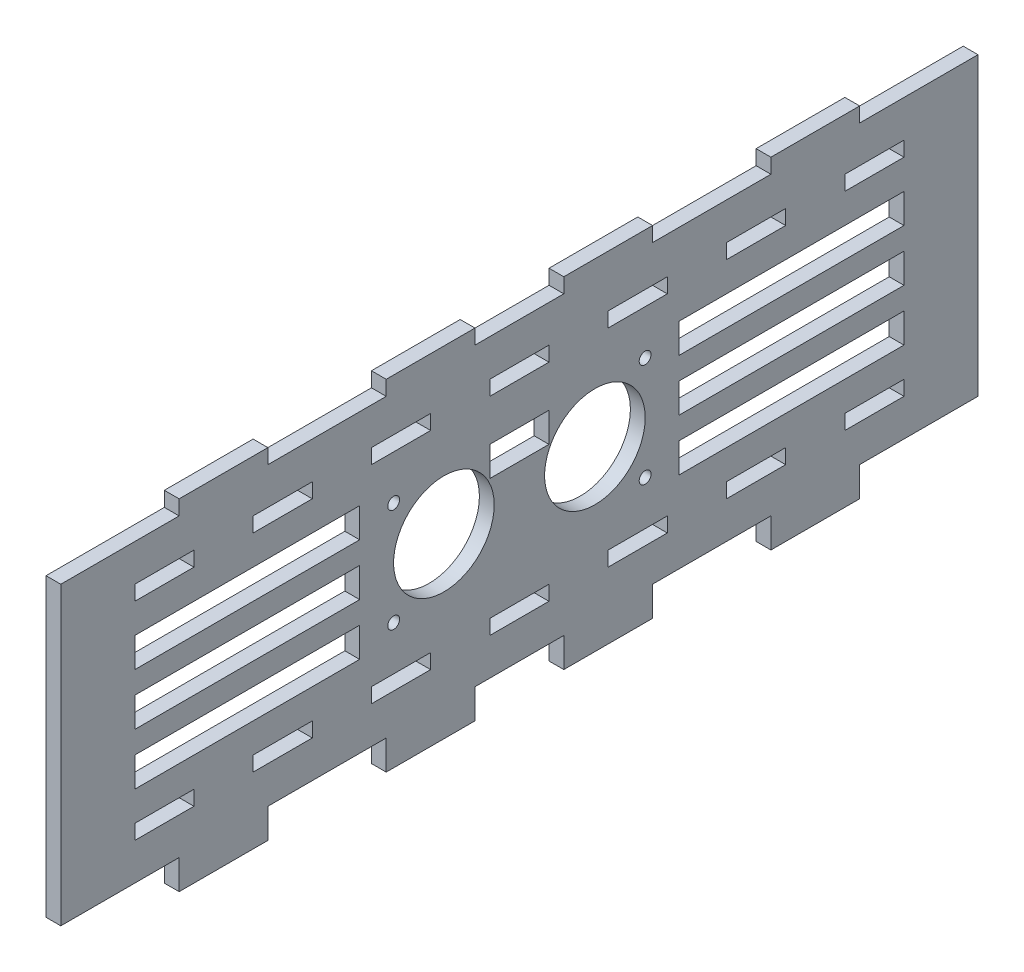
from build123d import *

# Parameters (mm, degrees)
SKETCH1_R           = 1
SKETCH1_R_2         = 8.5
SKETCH1_W           = 10
SKETCH1_H           = 2.5
SKETCH1_W_2         = 38
SKETCH1_H_2         = 5
BOSS_EXTRUDE1_DEPTH = 1.25


with BuildPart() as part:
    # Sketch1 → Boss-Extrude1 (new, symmetric)
    with BuildSketch(Plane(origin=(0, 0, 0), x_dir=(0, 0, -1), z_dir=(1, 0, 0))):
        Polygon((-77.50700933, 25), (-77.50700933, -25), (-57.50700933, -25), (-57.50700933, -30), (-42.50700933, -30), (-42.50700933, -25), (-22.50700933, -25), (-22.50700933, -30), (-7.50700933, -30), (-7.50700933, -25), (7.50700933, -25), (7.50700933, -30), (22.50700933, -30), (22.50700933, -25), (42.50700933, -25), (42.50700933, -30), (57.50700933, -30), (57.50700933, -25), (77.50700933, -25), (77.50700933, 25), (57.50700933, 25), (57.50700933, 27.5), (42.50700933, 27.5), (42.50700933, 25), (22.50700933, 25), (22.50700933, 27.5), (7.50700933, 27.5), (7.50700933, 25), (-7.50700933, 25), (-7.50700933, 27.5), (-22.50700933, 27.5), (-22.50700933, 25), (-42.50700933, 25), (-42.50700933, 27.5), (-57.50700933, 27.5), (-57.50700933, 25), align=None)
        with Locations((-21.25, 8.75)):
            Circle(SKETCH1_R, mode=Mode.SUBTRACT)
        with Locations((-12.76, 0)):
            Circle(SKETCH1_R_2, mode=Mode.SUBTRACT)
        with Locations((-21.25, -8.75)):
            Circle(SKETCH1_R, mode=Mode.SUBTRACT)
        with Locations((12.76, 0)):
            Circle(SKETCH1_R_2, mode=Mode.SUBTRACT)
        with Locations((21.25, -8.75)):
            Circle(SKETCH1_R, mode=Mode.SUBTRACT)
        with Locations((21.25, 8.75)):
            Circle(SKETCH1_R, mode=Mode.SUBTRACT)
        with Locations((0, 17.5)):
            Rectangle(SKETCH1_W, SKETCH1_H, mode=Mode.SUBTRACT)
        with Locations((-46, -8.75)):
            Rectangle(SKETCH1_W_2, SKETCH1_H_2, mode=Mode.SUBTRACT)
        with Locations((0, -17.5)):
            Rectangle(SKETCH1_W, SKETCH1_H, mode=Mode.SUBTRACT)
        with Locations((-20, -17.5)):
            Rectangle(SKETCH1_W, SKETCH1_H, mode=Mode.SUBTRACT)
        with Locations((-20, 17.5)):
            Rectangle(SKETCH1_W, SKETCH1_H, mode=Mode.SUBTRACT)
        with Locations((-40, -17.5)):
            Rectangle(SKETCH1_W, SKETCH1_H, mode=Mode.SUBTRACT)
        with Locations((-40, 17.5)):
            Rectangle(SKETCH1_W, SKETCH1_H, mode=Mode.SUBTRACT)
        with Locations((-60, -17.5)):
            Rectangle(SKETCH1_W, SKETCH1_H, mode=Mode.SUBTRACT)
        with Locations((-60, 17.5)):
            Rectangle(SKETCH1_W, SKETCH1_H, mode=Mode.SUBTRACT)
        with Locations((20, -17.5)):
            Rectangle(SKETCH1_W, SKETCH1_H, mode=Mode.SUBTRACT)
        with Locations((20, 17.5)):
            Rectangle(SKETCH1_W, SKETCH1_H, mode=Mode.SUBTRACT)
        with Locations((40, -17.5)):
            Rectangle(SKETCH1_W, SKETCH1_H, mode=Mode.SUBTRACT)
        with Locations((40, 17.5)):
            Rectangle(SKETCH1_W, SKETCH1_H, mode=Mode.SUBTRACT)
        with Locations((60, -17.5)):
            Rectangle(SKETCH1_W, SKETCH1_H, mode=Mode.SUBTRACT)
        with Locations((60, 17.5)):
            Rectangle(SKETCH1_W, SKETCH1_H, mode=Mode.SUBTRACT)
        with Locations((46, 8.75)):
            Rectangle(SKETCH1_W_2, SKETCH1_H_2, mode=Mode.SUBTRACT)
        with Locations((-46, 0)):
            Rectangle(SKETCH1_W_2, SKETCH1_H_2, mode=Mode.SUBTRACT)
        with Locations((-46, 8.75)):
            Rectangle(SKETCH1_W_2, SKETCH1_H_2, mode=Mode.SUBTRACT)
        with Locations((46, -8.75)):
            Rectangle(SKETCH1_W_2, SKETCH1_H_2, mode=Mode.SUBTRACT)
        with Locations((0, 6.72)):
            Rectangle(SKETCH1_W, SKETCH1_H_2, mode=Mode.SUBTRACT)
        with Locations((46, 0)):
            Rectangle(SKETCH1_W_2, SKETCH1_H_2, mode=Mode.SUBTRACT)
    extrude(amount=BOSS_EXTRUDE1_DEPTH, both=True)


solid = part.part
